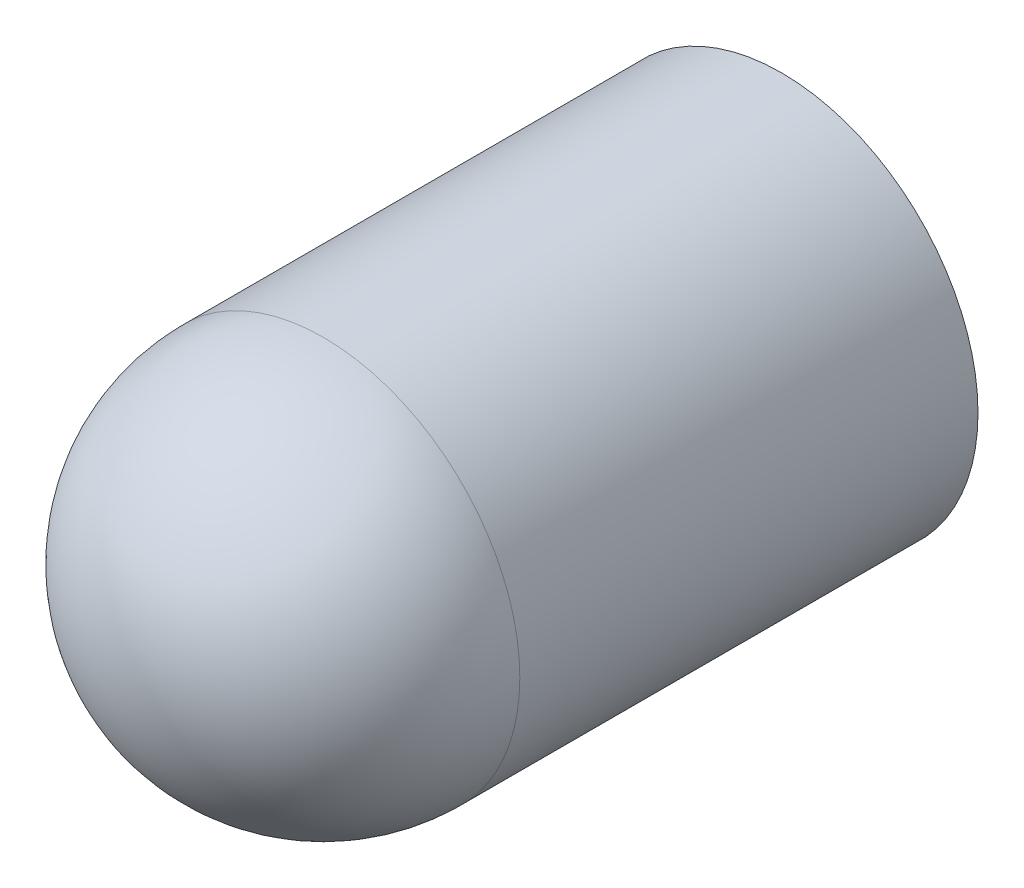
from build123d import *

# Parameters (mm, degrees)
BOSS_EXTRU_1_DEPTH      = 1.5
BOSS_EXTRU_1_DEPTH_BACK = 2
ESQUISSE1_R             = 1.5
R_VOLUTION1_ANGLE       = 180


with BuildPart() as part:
    # Esquisse1 → Boss.-Extru.1 (new, two sides: drawn at the far end of the back side and taken through both)
    with BuildSketch(Plane.XY.offset(-BOSS_EXTRU_1_DEPTH_BACK)):
        with Locations((5.735533906, -24.376115769)):
            Circle(ESQUISSE1_R)
    extrude(amount=BOSS_EXTRU_1_DEPTH + BOSS_EXTRU_1_DEPTH_BACK)

    # Esquisse2 → Révolution1 (revolve)
    with BuildSketch(Plane.XY.offset(1.5)):
        with BuildLine():
            Line((5.735533906, -25.876115769), (5.735533906, -22.876115769))
            ThreePointArc((5.735533906, -22.876115769), (4.235533906, -24.376115769), (5.735533906, -25.876115769))
        make_face()
    revolve(axis=Axis((5.735533906, -25.876115769, 1.5), (0, 1, 0)), revolution_arc=R_VOLUTION1_ANGLE)


solid = part.part
